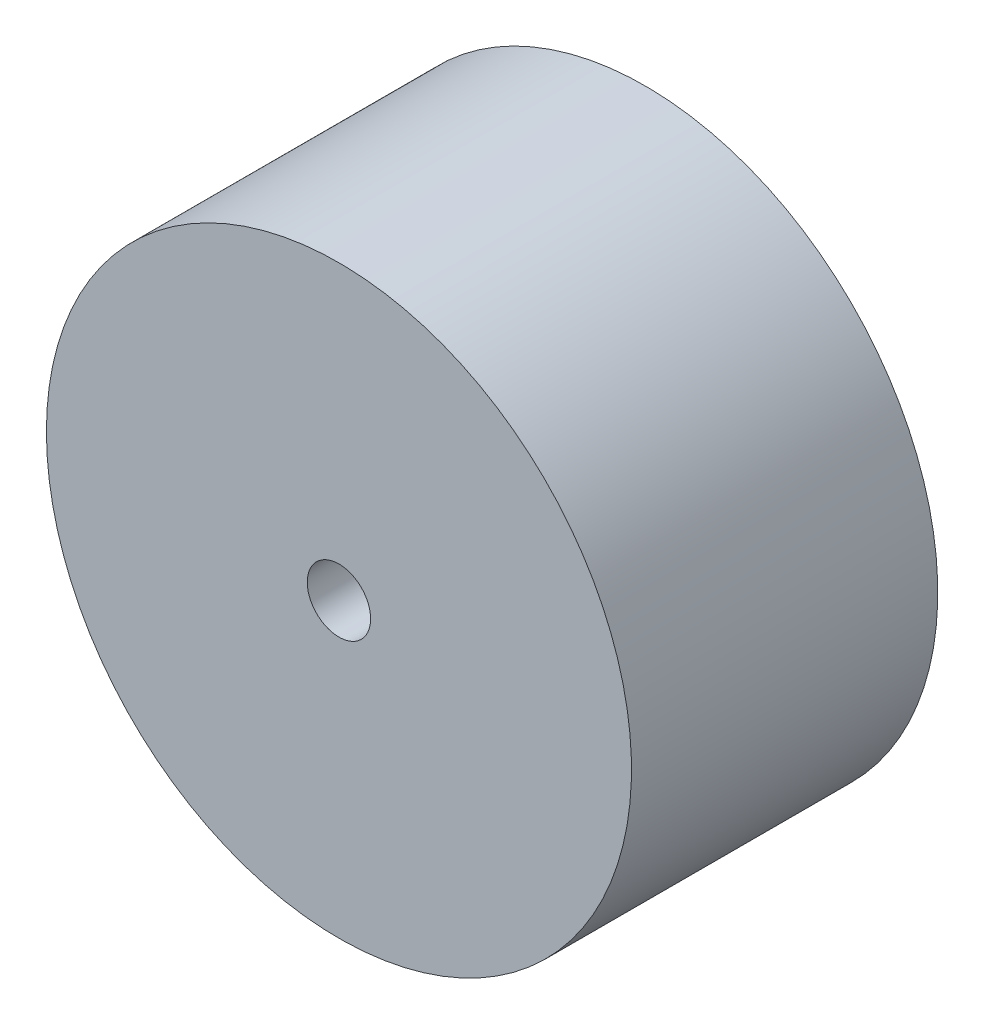
from build123d import *

# Parameters (mm, degrees)
SKETCH1_R           = 13.85
BOSS_EXTRUDE1_DEPTH = 14.5
SKETCH3_R           = 1.5
CUT_EXTRUDE1_DEPTH  = 14.5


with BuildPart() as part:
    # Sketch1 → Boss-Extrude1 (new body)
    with BuildSketch(Plane.XY):
        with Locations(Location((0, 0, 0), (0, 0, 180))):
            Circle(SKETCH1_R)
    extrude(amount=BOSS_EXTRUDE1_DEPTH)

    # Sketch3 → Cut-Extrude1 (cut)
    with BuildSketch(Plane(origin=(0, 0, 0), x_dir=(-1, 0, 0), z_dir=(0, 0, -1))):
        Circle(SKETCH3_R)
    extrude(amount=-CUT_EXTRUDE1_DEPTH, mode=Mode.SUBTRACT)


solid = part.part
